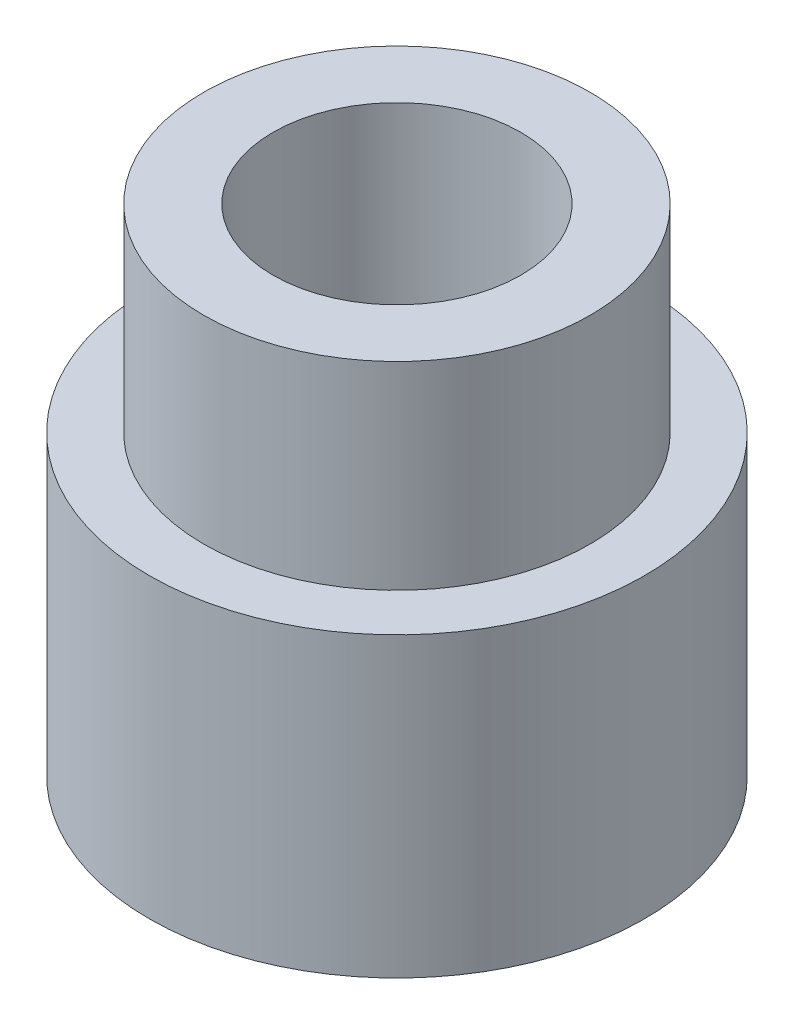
from build123d import *

# Parameters (mm, degrees)
SKETCH1_R                            = 31.75
BOSS_EXTRUDE1_DEPTH                  = 63.5
CUT_EXTRUDE2_START                   = -25.4
SKETCH2_R                            = 31.75
SKETCH2_R_2                          = 24.765
CUT_EXTRUDE2_DEPTH                   = 25.4
SKETCH3_R                            = 15.875
CUT_EXTRUDE3_DEPTH                   = 50.8
F_1_4_0_25_DIAMETER_HOLE1_AT_2_COUNT = 2
F_1_4_0_25_DIAMETER_HOLE1_AT_2_PITCH = 10.16
CIRPATTERN1_COUNT                    = 4


with BuildPart() as part:
    # Sketch1 → Boss-Extrude1 (new body)
    with BuildSketch(Plane(origin=(0, 0, 0), x_dir=(1, 0, 0), z_dir=(0, 1, 0))):
        with Locations(Location((0, 0, 0), (0, 0, 270))):
            Circle(SKETCH1_R)
    extrude(amount=BOSS_EXTRUDE1_DEPTH)

    # Sketch2 → Cut-Extrude2 (cut)
    with BuildSketch(Plane(origin=(0, 63.5, 0), x_dir=(1, 0, 0), z_dir=(0, 1, 0)).offset(CUT_EXTRUDE2_START)):
        with Locations(Location((0, 0, 0), (0, 0, 270))):
            Circle(SKETCH2_R)
        with Locations(Location((0, 0, 0), (0, 0, 270))):
            Circle(SKETCH2_R_2, mode=Mode.SUBTRACT)
    extrude(amount=CUT_EXTRUDE2_DEPTH, mode=Mode.SUBTRACT)

    # Sketch3 → Cut-Extrude3 (cut)
    with BuildSketch(Plane(origin=(0, 63.5, 0), x_dir=(1, 0, 0), z_dir=(0, 1, 0))):
        with Locations(Location((0, 0, 0), (0, 0, 270))):
            Circle(SKETCH3_R)
    extrude(amount=-CUT_EXTRUDE3_DEPTH, mode=Mode.SUBTRACT)

    # Sketch9 → 1/4 (0.25) Diameter Hole1 (revolve, cut)
    with BuildSketch(Plane(origin=(0, 0, -10.16), x_dir=(0, 0, -1), z_dir=(1, 0, 0))):
        Polygon((0, 0), (0, 14.607732465), (3.175, 12.7), (3.175, 0), align=None)
    f_1_4_0_25_diameter_hole1 = revolve(axis=Axis((0, -6.35, -10.16), (0, 1, 0)), mode=Mode.SUBTRACT)

    # 1/4 (0.25) Diameter Hole1 at 2: 1/4 (0.25) Diameter Hole1 ×2
    with Locations(*[(0, 0, i * F_1_4_0_25_DIAMETER_HOLE1_AT_2_PITCH) for i in range(1, F_1_4_0_25_DIAMETER_HOLE1_AT_2_COUNT)]):
        add(f_1_4_0_25_diameter_hole1, mode=Mode.SUBTRACT)

    # CirPattern1: 1/4 (0.25) Diameter Hole1 ×4 about axis
    cirpattern1_axis = Axis((0, 0, 0), (0, 1, 0))
    for i in range(1, CIRPATTERN1_COUNT):
        add(f_1_4_0_25_diameter_hole1.rotate(cirpattern1_axis, i * 360 / CIRPATTERN1_COUNT), mode=Mode.SUBTRACT)

    # CirPattern1 copy 1 sketch → CirPattern1 copy 1 (revolve, cut)
    with BuildSketch(Plane(origin=(0, 0, 0), x_dir=(-1, 0, 0), z_dir=(0, 0, -1))):
        Polygon((0, 0), (0, 14.607732465), (3.175, 12.7), (3.175, 0), align=None)
    revolve(axis=Axis((0, -6.35, 0), (0, 1, 0)), mode=Mode.SUBTRACT)

    # CirPattern1 copy 2 sketch → CirPattern1 copy 2 (revolve, cut)
    with BuildSketch(Plane.ZY):
        Polygon((0, 0), (0, 14.607732465), (3.175, 12.7), (3.175, 0), align=None)
    revolve(axis=Axis((0, -6.35, 0), (0, 1, 0)), mode=Mode.SUBTRACT)

    # CirPattern1 copy 3 sketch → CirPattern1 copy 3 (revolve, cut)
    with BuildSketch(Plane.XY):
        Polygon((0, 0), (0, 14.607732465), (3.175, 12.7), (3.175, 0), align=None)
    revolve(axis=Axis((0, -6.35, 0), (0, 1, 0)), mode=Mode.SUBTRACT)


solid = part.part
